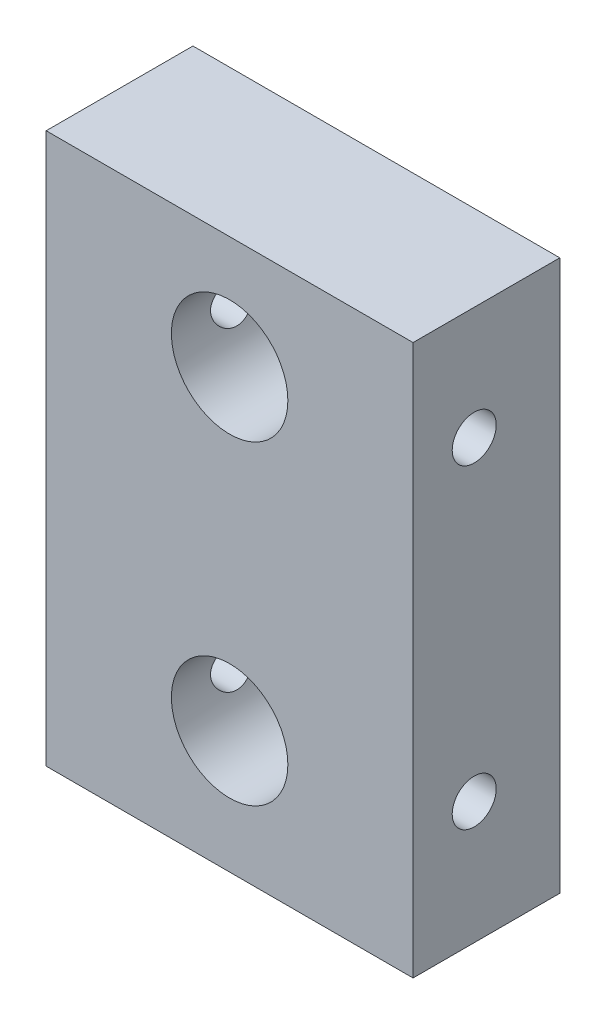
from build123d import *

# Parameters (mm, degrees)
ESBO_O1_W                   = 30
ESBO_O1_H                   = 45
ESBO_O1_R                   = 4.7625
RESSALTO_EXTRUS_O1_DEPTH    = 12
FURO_COM_FOLGA_DE_M31_D     = 3.6
FURO_COM_FOLGA_DE_M31_DEPTH = 30
FURO_COM_FOLGA_DE_M31_TIP   = 1.081549114


with BuildPart() as part:
    # Esboço1 → Ressalto-extrusão1 (new body)
    with BuildSketch(Plane.XY.offset(-196.305879913)):
        with Locations((18.764782864, 16.732361179)):
            Rectangle(ESBO_O1_W, ESBO_O1_H)
        with Locations((18.764782864, 30.002354844)):
            Circle(ESBO_O1_R, mode=Mode.SUBTRACT)
        with Locations((18.764782864, 4.232361179)):
            Circle(ESBO_O1_R, mode=Mode.SUBTRACT)
    extrude(amount=RESSALTO_EXTRUS_O1_DEPTH)

    # Furo com folga de M31
    with Locations(Plane.ZY.offset(-3.764782864)):
        with Locations((-189.305879913, 30.002361179), (-189.305879913, 4.232361179)):
            Hole(FURO_COM_FOLGA_DE_M31_D / 2, depth=FURO_COM_FOLGA_DE_M31_DEPTH)
            with Locations((0, 0, -(FURO_COM_FOLGA_DE_M31_DEPTH + FURO_COM_FOLGA_DE_M31_TIP / 2))):  # 118° drill point
                Cone(0, FURO_COM_FOLGA_DE_M31_D / 2, FURO_COM_FOLGA_DE_M31_TIP, mode=Mode.SUBTRACT)


solid = part.part
